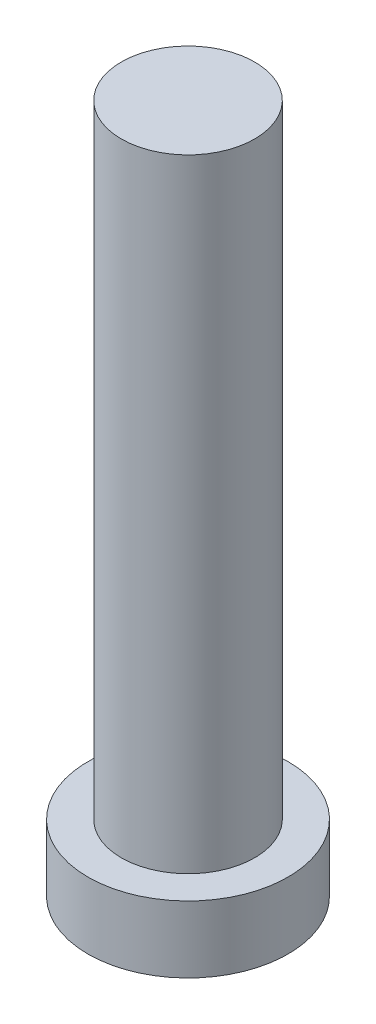
from build123d import *

# Parameters (mm, degrees)
CROQUIS1_R              = 7.5
SALIENTE_EXTRUIR1_DEPTH = 5
CROQUIS2_R              = 5
SALIENTE_EXTRUIR2_DEPTH = 20
ESCALA1_SCALE           = 0.75
CROQUIS4_R              = 3.75
SALIENTE_EXTRUIR3_DEPTH = 20


with BuildPart() as part:
    # Croquis1 → Saliente-Extruir1 (new body)
    with BuildSketch(Plane(origin=(0, 0, 0), x_dir=(1, 0, 0), z_dir=(0, 1, 0))):
        with Locations(Location((0, 0, 0), (0, 0, 270))):
            Circle(CROQUIS1_R)
    extrude(amount=SALIENTE_EXTRUIR1_DEPTH)

    # Croquis2 → Saliente-Extruir2 (add)
    with BuildSketch(Plane(origin=(0, 5, 0), x_dir=(1, 0, 0), z_dir=(0, 1, 0))):
        with Locations(Location((0, 0, 0), (0, 0, 270))):
            Circle(CROQUIS2_R)
    extrude(amount=SALIENTE_EXTRUIR2_DEPTH)


with BuildPart() as part_1:
    # Escala1: scaled about (0, 10.5, 0)
    add(part.part.scale(ESCALA1_SCALE).moved(Location((0, 2.625, 0))))

    # Croquis4 → Saliente-Extruir3 (add)
    with BuildSketch(Plane(origin=(0, 21.375, 0), x_dir=(1, 0, 0), z_dir=(0, 1, 0))):
        with Locations(Location((0, 0, 0), (0, 0, 270))):
            Circle(CROQUIS4_R)
    extrude(amount=SALIENTE_EXTRUIR3_DEPTH)


solid = part_1.part
